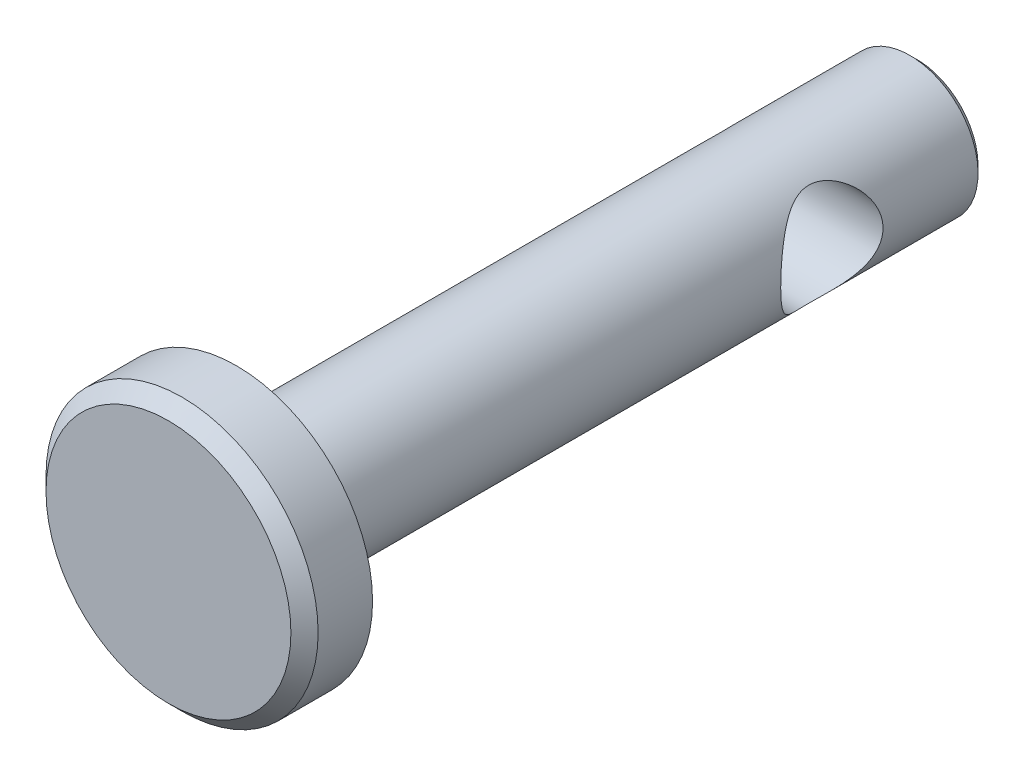
from build123d import *

# Parameters (mm, degrees)
CUT_EXTRUDE1_DEPTH      = 23.674035261
CUT_EXTRUDE1_DEPTH_BACK = 23.674035261
SKETCH2_R               = 1.1938
CHAMFER1_SIZE           = 0.3175
CHAMFER2_SIZE           = 0.15875


with BuildPart() as part:
    # Sketch4 → Revolve1 (revolve)
    with BuildSketch(Plane(origin=(0, 0, 0), x_dir=(0, 0, -1), z_dir=(1, 0, 0)), mode=Mode.PRIVATE) as revolve1_sk:
        Polygon((-1.5875, 0), (15.875, 0), (15.875, 1.5875), (0, 1.5875), (0, 3.175), (-1.5875, 3.175), align=None)
    revolve(revolve1_sk.sketch.rotate(Axis((0, 0, 1.5875), (0, 0, -1)), 180), axis=Axis((0, 0, 1.5875), (0, 0, -1)))

    # Sketch2 → Cut-Extrude1 (cut, two sides: drawn at the far end of the back side and taken through both)
    with BuildSketch(Plane(origin=(0, 0, 6.35), x_dir=(0, 0, 1), z_dir=(-1, 0, 0)).offset(-CUT_EXTRUDE1_DEPTH_BACK)):
        with Locations((-18.6563, 0)):
            Circle(SKETCH2_R)
    extrude(amount=CUT_EXTRUDE1_DEPTH + CUT_EXTRUDE1_DEPTH_BACK, mode=Mode.SUBTRACT)

    # Chamfer1
    chamfer1_edges = [part.edges().sort_by_distance(p)[0] for p in [
        (0, 3.175, 1.5875),
    ]]
    chamfer(chamfer1_edges, length=CHAMFER1_SIZE)

    # Chamfer2
    chamfer2_edges = [part.edges().sort_by_distance(p)[0] for p in [
        (0, 1.5875, -15.875),
    ]]
    chamfer(chamfer2_edges, length=CHAMFER2_SIZE)


solid = part.part
